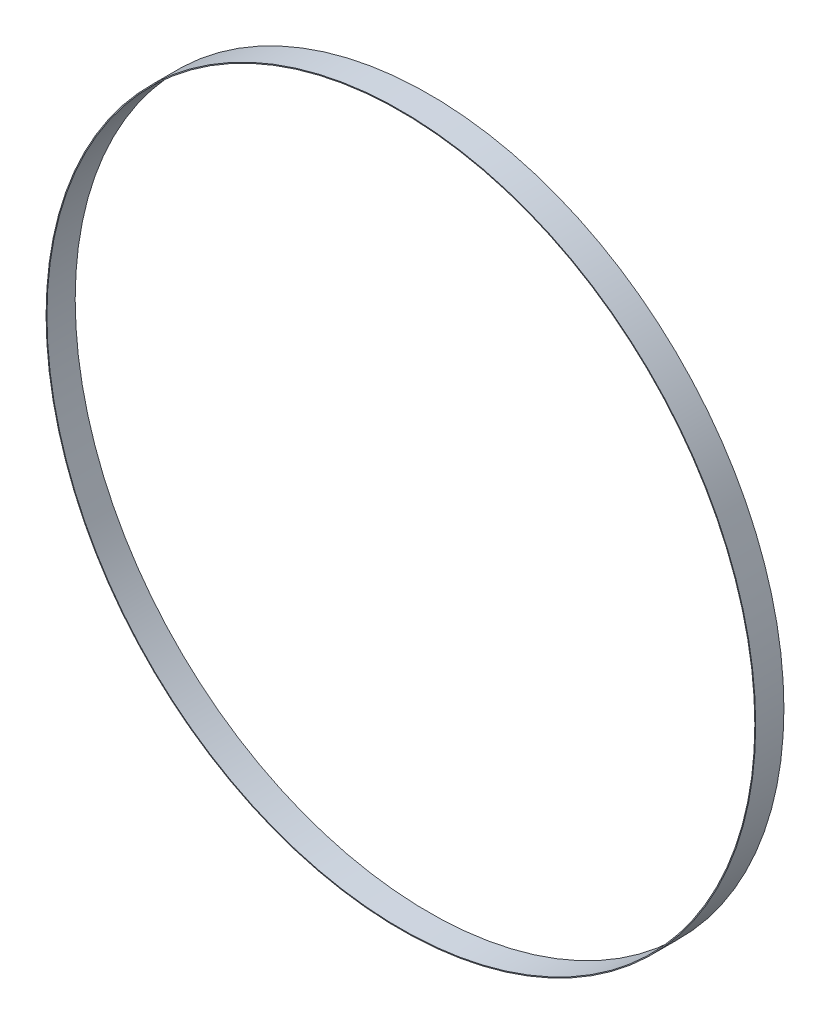
from build123d import *

# Parameters (mm, degrees)
SKETCH1_R           = 1256
SKETCH1_R_2         = 1253
BOSS_EXTRUDE1_DEPTH = 100


with BuildPart() as part:
    # Sketch1 → Boss-Extrude1 (new body)
    with BuildSketch(Plane.XY):
        Circle(SKETCH1_R)
        Circle(SKETCH1_R_2, mode=Mode.SUBTRACT)
    extrude(amount=BOSS_EXTRUDE1_DEPTH)


solid = part.part
